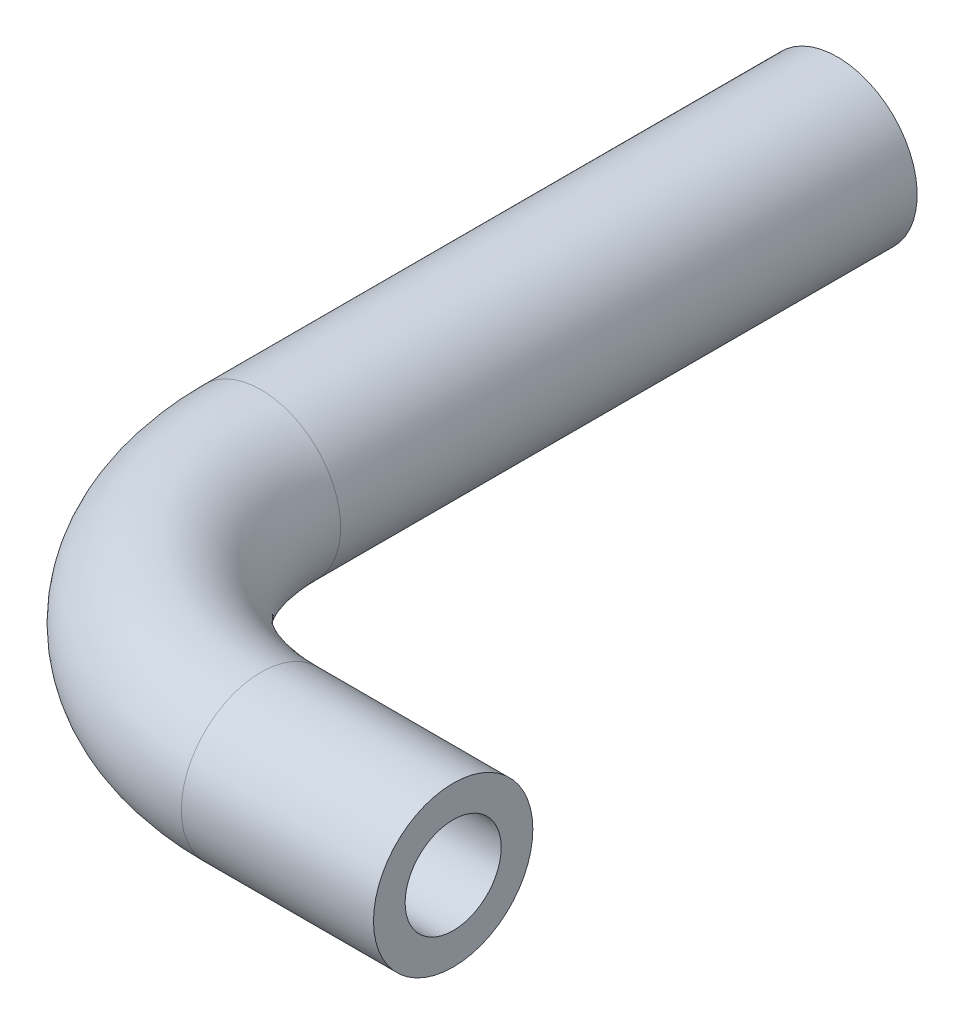
from build123d import *

# Parameters (mm, degrees)
SKETCH2_R           = 10.530885837
SKETCH2_R_2         = 6.35
SKETCH3_R           = 10.530885837
SKETCH3_R_2         = 6.35
BOSS_EXTRUDE1_DEPTH = 76.2
SKETCH4_R           = 10.530885837
SKETCH4_R_2         = 6.35
BOSS_EXTRUDE2_DEPTH = 25.4


with BuildPart() as part:
    # Sweep1: sweep along a path in Sketch1
    with BuildLine(Plane(origin=(0, 0, 0), x_dir=(1, 0, 0), z_dir=(0, 1, 0))) as sweep1_path:
        ThreePointArc((0, 0), (-22.86803443, 9.472250006), (-32.340284436, 32.340284436))
    # Sketch2 → Sweep1 (sweep)
    with BuildSketch(Plane(origin=(0, 0, 0), x_dir=(0, 0, -1), z_dir=(1, 0, 0))):
        Circle(SKETCH2_R)
        Circle(SKETCH2_R_2, mode=Mode.SUBTRACT)
    sweep(path=sweep1_path.line)

    # Sketch3 → Boss-Extrude1 (add)
    with BuildSketch(Plane(origin=(0, 0, -32.340284436), x_dir=(-1, 0, 0), z_dir=(0, 0, -1))):
        with Locations((32.340284436, 0)):
            Circle(SKETCH3_R)
        with Locations((32.340284436, 0)):
            Circle(SKETCH3_R_2, mode=Mode.SUBTRACT)
    extrude(amount=BOSS_EXTRUDE1_DEPTH)

    # Sketch4 → Boss-Extrude2 (add)
    with BuildSketch(Plane(origin=(0, 0, 0), x_dir=(0, 0, -1), z_dir=(1, 0, 0))):
        with Locations(Location((0, 0, 0), (0, 0, 180))):
            Circle(SKETCH4_R)
        with Locations(Location((0, 0, 0), (0, 0, 180))):
            Circle(SKETCH4_R_2, mode=Mode.SUBTRACT)
    extrude(amount=BOSS_EXTRUDE2_DEPTH)


solid = part.part
